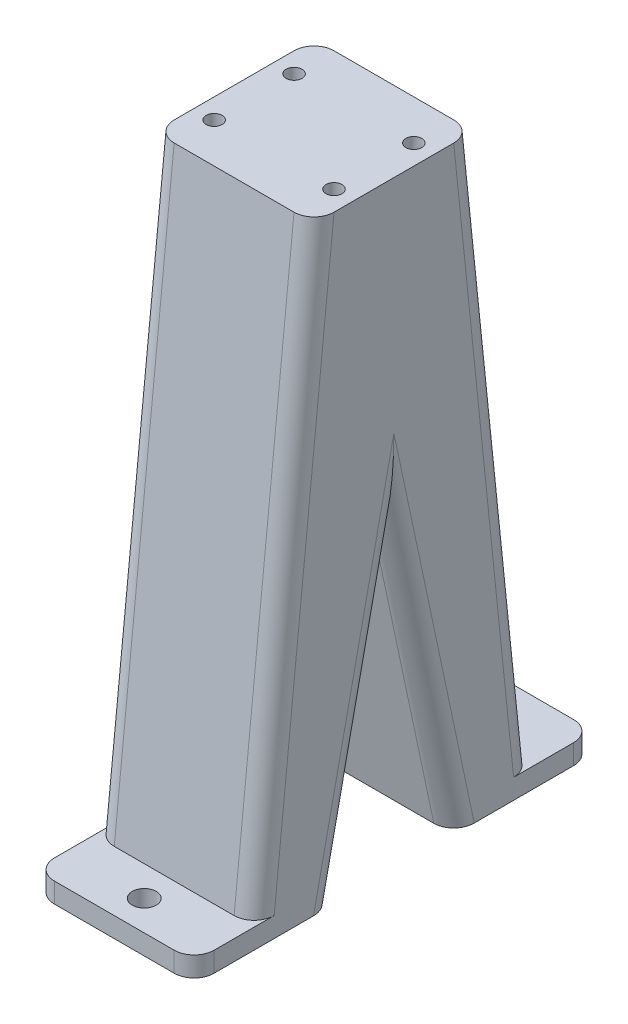
from build123d import *

# Parameters (mm, degrees)
BOSS_EXTRUDE1_DEPTH = 40
SKETCH2_R           = 3
CUT_EXTRUDE1_DEPTH  = 40
CUT_EXTRUDE2_DEPTH  = 40
FILLET1_R           = 5


with BuildPart() as part:
    # Sketch1 → Boss-Extrude1 (new body)
    with BuildSketch(Plane(origin=(0, 0, 0), x_dir=(0, 0, -1), z_dir=(1, 0, 0))):
        Polygon((-20, 150), (20, 150), (35, 5), (50, 5), (50, 0), (15, 0), (0, 70.528805369), (-15, 0), (-50, 0), (-50, 5), (-35, 5), align=None)
    extrude(amount=BOSS_EXTRUDE1_DEPTH)

    # Sketch2 → Cut-Extrude1 (cut)
    with BuildSketch(Plane(origin=(0, 5, 0), x_dir=(1, 0, 0), z_dir=(0, 1, 0))):
        with Locations(Location((20, 42.5, 0), (0, 0, 270))):
            Circle(SKETCH2_R)
        with Locations(Location((20, -42.5, 0), (0, 0, 270))):
            Circle(SKETCH2_R)
    extrude(amount=-CUT_EXTRUDE1_DEPTH, mode=Mode.SUBTRACT)

    # Sketch3 → Cut-Extrude2 (cut)
    with BuildSketch(Plane(origin=(0, 150, 0), x_dir=(1, 0, 0), z_dir=(0, 1, 0))):
        with BuildLine():
            ThreePointArc((35, -8), (33.585786438, -8.585786438), (33, -10))
            Line((33, -10), (35, -10))
            Line((35, -10), (35, -8))
        make_face()
        with BuildLine():
            Line((35, -10), (33, -10))
            ThreePointArc((33, -10), (35, -12), (37, -10))
            ThreePointArc((37, -10), (36.414213562, -8.585786438), (35, -8))
            Line((35, -8), (35, -10))
        make_face()
        with BuildLine():
            ThreePointArc((33, 10), (33.585786438, 8.585786438), (35, 8))
            Line((35, 8), (35, 10))
            Line((35, 10), (33, 10))
        make_face()
        with BuildLine():
            Line((35, 10), (35, 8))
            ThreePointArc((35, 8), (36.414213562, 8.585786438), (37, 10))
            ThreePointArc((37, 10), (35, 12), (33, 10))
            Line((33, 10), (35, 10))
        make_face()
        with BuildLine():
            ThreePointArc((7, 10), (3.585786438, 11.414213562), (5, 8))
            Line((5, 8), (5, 10))
            Line((5, 10), (7, 10))
        make_face()
        with BuildLine():
            Line((5, 10), (5, 8))
            ThreePointArc((5, 8), (6.414213562, 8.585786438), (7, 10))
            Line((7, 10), (5, 10))
        make_face()
        with BuildLine():
            Line((5, -8), (5, -10))
            Line((5, -10), (7, -10))
            ThreePointArc((7, -10), (6.414213562, -8.585786438), (5, -8))
        make_face()
        with BuildLine():
            Line((7, -10), (5, -10))
            Line((5, -10), (5, -8))
            ThreePointArc((5, -8), (3.585786438, -11.414213562), (7, -10))
        make_face()
    extrude(amount=-CUT_EXTRUDE2_DEPTH, mode=Mode.SUBTRACT)

    # Fillet1
    fillet1_edges = [part.edges().sort_by_distance(p)[0] for p in [
        (0, 2.5, -50),
        (0, 35.264402685, -7.5),
        (0, 35.264402685, 7.5),
        (40, 77.5, 27.5),
        (0, 2.5, 50),
        (0, 77.5, 27.5),
        (0, 77.5, -27.5),
        (40, 2.5, 50),
        (40, 35.264402685, 7.5),
        (40, 35.264402685, -7.5),
        (40, 2.5, -50),
        (40, 77.5, -27.5),
    ]]
    fillet(fillet1_edges, radius=FILLET1_R)


solid = part.part
